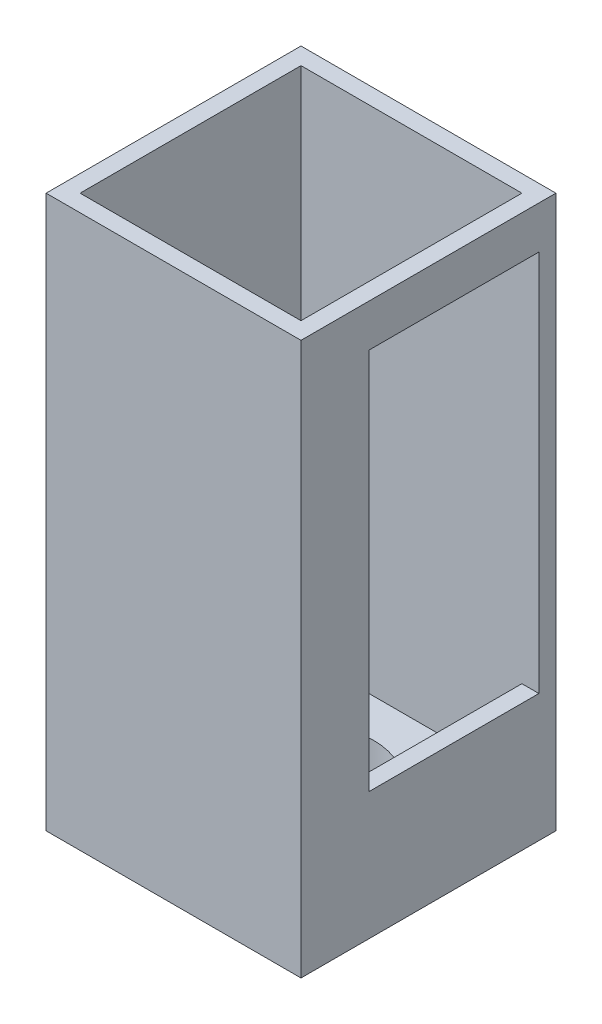
from build123d import *

# Parameters (mm, degrees)
SALIENTE_EXTRUIR1_DEPTH      = 60
SALIENTE_EXTRUIR1_DEPTH_BACK = 5
CROQUIS1_W                   = 30
CROQUIS1_H                   = 30
CROQUIS2_W                   = 26
CROQUIS2_H                   = 26
CORTAR_EXTRUIR3_DEPTH        = 65
CROQUIS3_W                   = 20
CROQUIS3_H                   = 45
CORTAR_EXTRUIR4_DEPTH        = 2
CROQUIS4_W                   = 26
CROQUIS4_H                   = 26
SALIENTE_EXTRUIR2_DEPTH      = 5
CROQUIS5_R                   = 8.5
CORTAR_EXTRUIR5_DEPTH        = 5


with BuildPart() as part:
    # Croquis1 → Saliente-Extruir1 (new, two sides: drawn at the far end of the back side and taken through both)
    with BuildSketch(Plane(origin=(0, 0, 0), x_dir=(1, 0, 0), z_dir=(0, 1, 0)).offset(-SALIENTE_EXTRUIR1_DEPTH_BACK)):
        Rectangle(CROQUIS1_W, CROQUIS1_H)
    extrude(amount=SALIENTE_EXTRUIR1_DEPTH + SALIENTE_EXTRUIR1_DEPTH_BACK)

    # Croquis2 → Cortar-Extruir3 (cut)
    with BuildSketch(Plane(origin=(0, 60, 0), x_dir=(1, 0, 0), z_dir=(0, 1, 0))):
        Rectangle(CROQUIS2_W, CROQUIS2_H)
    extrude(amount=-CORTAR_EXTRUIR3_DEPTH, mode=Mode.SUBTRACT)

    # Croquis3 → Cortar-Extruir4 (cut)
    with BuildSketch(Plane(origin=(15, 0, 0), x_dir=(0, 0, -1), z_dir=(1, 0, 0))):
        with Locations((3, 32.5)):
            Rectangle(CROQUIS3_W, CROQUIS3_H)
    extrude(amount=-CORTAR_EXTRUIR4_DEPTH, mode=Mode.SUBTRACT)

    # Croquis4 → Saliente-Extruir2 (add)
    with BuildSketch(Plane.XZ.offset(5)):
        Rectangle(CROQUIS4_W, CROQUIS4_H)
    extrude(amount=-SALIENTE_EXTRUIR2_DEPTH)

    # Croquis5 → Cortar-Extruir5 (cut)
    with BuildSketch(Plane.XZ.offset(5)):
        with Locations(Location((0, 0, 0), (0, 0, 270))):
            Circle(CROQUIS5_R)
    extrude(amount=-CORTAR_EXTRUIR5_DEPTH, mode=Mode.SUBTRACT)


solid = part.part
